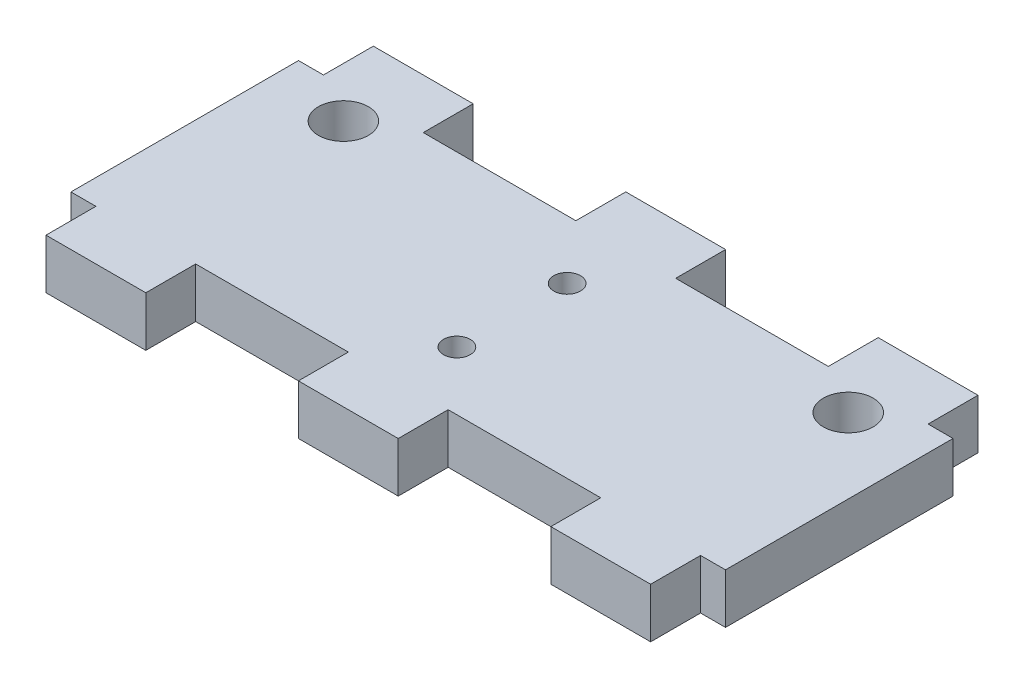
from build123d import *

# Parameters (mm, degrees)
SKETCH1_R           = 3.175
SKETCH1_R_2         = 1.70053
BOSS_EXTRUDE1_DEPTH = 6.35


with BuildPart() as part:
    # Sketch1 → Boss-Extrude1 (new body)
    with BuildSketch(Plane(origin=(0, 0, 0), x_dir=(1, 0, 0), z_dir=(0, 1, 0))):
        Polygon((-41.64584, 14.478), (-38.47084, 14.478), (-38.47084, 20.828), (-25.77084, 20.828), (-25.77084, 14.478), (-6.35, 14.478), (-6.35, 20.828), (6.35, 20.828), (6.35, 14.478), (25.77084, 14.478), (25.77084, 20.828), (38.47084, 20.828), (38.47084, 14.478), (41.64584, 14.478), (41.64584, -14.478), (38.47084, -14.478), (38.47084, -20.828), (25.77084, -20.828), (25.77084, -14.478), (6.35, -14.478), (6.35, -20.828), (-6.35, -20.828), (-6.35, -14.478), (-25.77084, -14.478), (-25.77084, -20.828), (-38.47084, -20.828), (-38.47084, -14.478), (-41.64584, -14.478), align=None)
        with Locations(Location((32.12084, 10.668, 0), (0, 0, 270))):
            Circle(SKETCH1_R, mode=Mode.SUBTRACT)
        with Locations(Location((0, 7.01548, 0), (0, 0, 270))):
            Circle(SKETCH1_R_2, mode=Mode.SUBTRACT)
        with Locations(Location((-32.12084, 10.668, 0), (0, 0, 270))):
            Circle(SKETCH1_R, mode=Mode.SUBTRACT)
        with Locations(Location((0, -7.01548, 0), (0, 0, 270))):
            Circle(SKETCH1_R_2, mode=Mode.SUBTRACT)
    extrude(amount=BOSS_EXTRUDE1_DEPTH)


solid = part.part
